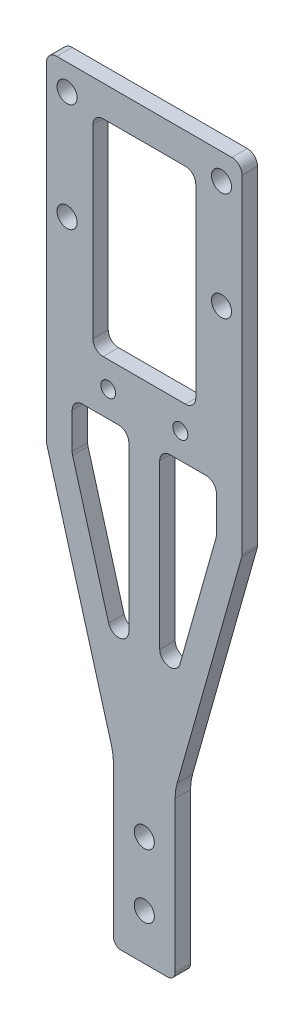
from build123d import *

# Parameters (mm, degrees)
SKETCH_1_R          = 1.95
EXTRUDE_1_DEPTH     = 3
SKETCH_2_R          = 1.45
SKETCH_2_W          = 20
SKETCH_2_H          = 40
CUT_EXTRUDE_1_DEPTH = 10
FILLET_1_R          = 1.5
FILLET_2_R          = 10
FILLET_3_R          = 2


with BuildPart() as part:
    # 草图1 → 凸台-拉伸1 (new body)
    with BuildSketch(Plane.XY):
        Polygon((0, 0), (0, 66), (38, 66), (38, 0), (25, -45.927575687), (25, -78.1), (13, -78.1), (13, -45.927575687), align=None)
        with Locations((4, 40)):
            Circle(SKETCH_1_R, mode=Mode.SUBTRACT)
        with Locations((34, 40)):
            Circle(SKETCH_1_R, mode=Mode.SUBTRACT)
        with Locations((4, 61)):
            Circle(SKETCH_1_R, mode=Mode.SUBTRACT)
        with Locations((34, 61)):
            Circle(SKETCH_1_R, mode=Mode.SUBTRACT)
        with Locations((19, -56.8)):
            Circle(SKETCH_1_R, mode=Mode.SUBTRACT)
        with Locations((19, -69.2)):
            Circle(SKETCH_1_R, mode=Mode.SUBTRACT)
    extrude(amount=EXTRUDE_1_DEPTH)

    # 草图2 → 切除-拉伸1 (cut)
    with BuildSketch(Plane.XY.offset(3)):
        with Locations((12, 15)):
            Circle(SKETCH_2_R)
        with Locations((26, 15)):
            Circle(SKETCH_2_R)
        Polygon((5, 10), (16, 10), (16, -38.16779197), (5, 0.694002842), align=None)
        with Locations((19, 40)):
            Rectangle(SKETCH_2_W, SKETCH_2_H)
        Polygon((22, 10), (22, -38.16779197), (33, 0.694002842), (33, 10), align=None)
    extrude(amount=-CUT_EXTRUDE_1_DEPTH, mode=Mode.SUBTRACT)

    # 圆角1
    fillet_1_edges = [part.edges().sort_by_distance(p)[0] for p in [
        (0, 0, 1.5),
        (38, 0, 1.5),
        (25, -78.1, 1.5),
        (13, -78.1, 1.5),
    ]]
    fillet(fillet_1_edges, radius=FILLET_1_R)

    # 圆角2
    fillet_2_edges = [part.edges().sort_by_distance(p)[0] for p in [
        (25, -45.927575687, 1.5),
        (13, -45.927575687, 1.5),
    ]]
    fillet(fillet_2_edges, radius=FILLET_2_R)

    # 圆角3
    fillet_3_edges = [part.edges().sort_by_distance(p)[0] for p in [
        (0, 66, 1.5),
        (38, 66, 1.5),
        (9, 20, 1.5),
        (9, 60, 1.5),
        (29, 60, 1.5),
        (29, 20, 1.5),
        (5, 0.694002842, 1.5),
        (5, 10, 1.5),
        (16, 10, 1.5),
        (16, -38.16779197, 1.5),
        (22, 10, 1.5),
        (33, 10, 1.5),
        (33, 0.694002842, 1.5),
        (22, -38.16779197, 1.5),
    ]]
    fillet(fillet_3_edges, radius=FILLET_3_R)


solid = part.part
